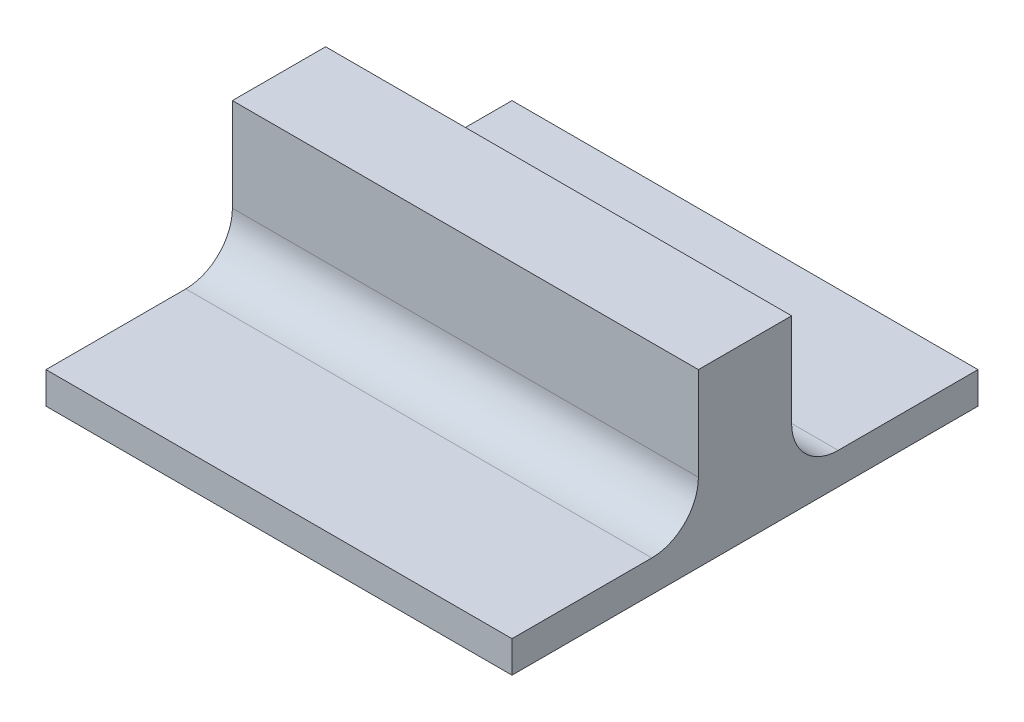
from build123d import *

# Parameters (mm, degrees)
SKETCH1_W           = 50
SKETCH1_H           = 50
BOSS_EXTRUDE1_DEPTH = 1.4
SKETCH2_W           = 50
SKETCH2_H           = 50
BOSS_EXTRUDE2_DEPTH = 2
SKETCH3_W           = 50
SKETCH3_H           = 10
BOSS_EXTRUDE3_DEPTH = 15
FILLET1_R           = 5


with BuildPart() as part:
    # Sketch1 → Boss-Extrude1 (new body)
    with BuildSketch(Plane(origin=(0, 0, 0), x_dir=(1, 0, 0), z_dir=(0, 1, 0))):
        Rectangle(SKETCH1_W, SKETCH1_H)
        Polygon((-13.067802911, 20), (-14.222503449, 22), (-16.531904526, 22), (-17.686605064, 20), (-16.531904526, 18), (-14.222503449, 18), align=None, mode=Mode.SUBTRACT)
        Polygon((-19.218684506, 20), (-20.373385044, 22), (-22.682786121, 22), (-23.837486659, 20), (-22.682786121, 18), (-20.373385044, 18), align=None, mode=Mode.SUBTRACT)
        Polygon((-6.916921316, 20), (-8.071621854, 22), (-10.381022931, 22), (-11.535723469, 20), (-10.381022931, 18), (-8.071621854, 18), align=None, mode=Mode.SUBTRACT)
        Polygon((-0.766039721, 20), (-1.920740259, 22), (-4.230141336, 22), (-5.384841874, 20), (-4.230141336, 18), (-1.920740259, 18), align=None, mode=Mode.SUBTRACT)
        Polygon((5.384841874, 20), (4.230141336, 22), (1.920740259, 22), (0.766039721, 20), (1.920740259, 18), (4.230141336, 18), align=None, mode=Mode.SUBTRACT)
        Polygon((11.535723469, 20), (10.381022931, 22), (8.071621854, 22), (6.916921316, 20), (8.071621854, 18), (10.381022931, 18), align=None, mode=Mode.SUBTRACT)
        Polygon((17.686605064, 20), (16.531904526, 22), (14.222503449, 22), (13.067802911, 20), (14.222503449, 18), (16.531904526, 18), align=None, mode=Mode.SUBTRACT)
        Polygon((23.837486659, 20), (22.682786121, 22), (20.373385044, 22), (19.218684506, 20), (20.373385044, 18), (22.682786121, 18), align=None, mode=Mode.SUBTRACT)
        Polygon((-13.067802911, 12), (-14.222503449, 14), (-16.531904526, 14), (-17.686605064, 12), (-16.531904526, 10), (-14.222503449, 10), align=None, mode=Mode.SUBTRACT)
        Polygon((-6.916921316, 12), (-8.071621854, 14), (-10.381022931, 14), (-11.535723469, 12), (-10.381022931, 10), (-8.071621854, 10), align=None, mode=Mode.SUBTRACT)
        Polygon((-0.766039721, 12), (-1.920740259, 14), (-4.230141336, 14), (-5.384841874, 12), (-4.230141336, 10), (-1.920740259, 10), align=None, mode=Mode.SUBTRACT)
        Polygon((5.384841874, 12), (4.230141336, 14), (1.920740259, 14), (0.766039721, 12), (1.920740259, 10), (4.230141336, 10), align=None, mode=Mode.SUBTRACT)
        Polygon((11.535723469, 12), (10.381022931, 14), (8.071621854, 14), (6.916921316, 12), (8.071621854, 10), (10.381022931, 10), align=None, mode=Mode.SUBTRACT)
        Polygon((17.686605064, 12), (16.531904526, 14), (14.222503449, 14), (13.067802911, 12), (14.222503449, 10), (16.531904526, 10), align=None, mode=Mode.SUBTRACT)
        Polygon((23.837486659, 12), (22.682786121, 14), (20.373385044, 14), (19.218684506, 12), (20.373385044, 10), (22.682786121, 10), align=None, mode=Mode.SUBTRACT)
        Polygon((-13.067802911, 4), (-14.222503449, 6), (-16.531904526, 6), (-17.686605064, 4), (-16.531904526, 2), (-14.222503449, 2), align=None, mode=Mode.SUBTRACT)
        Polygon((-6.916921316, 4), (-8.071621854, 6), (-10.381022931, 6), (-11.535723469, 4), (-10.381022931, 2), (-8.071621854, 2), align=None, mode=Mode.SUBTRACT)
        Polygon((-0.766039721, 4), (-1.920740259, 6), (-4.230141336, 6), (-5.384841874, 4), (-4.230141336, 2), (-1.920740259, 2), align=None, mode=Mode.SUBTRACT)
        Polygon((5.384841874, 4), (4.230141336, 6), (1.920740259, 6), (0.766039721, 4), (1.920740259, 2), (4.230141336, 2), align=None, mode=Mode.SUBTRACT)
        Polygon((11.535723469, 4), (10.381022931, 6), (8.071621854, 6), (6.916921316, 4), (8.071621854, 2), (10.381022931, 2), align=None, mode=Mode.SUBTRACT)
        Polygon((17.686605064, 4), (16.531904526, 6), (14.222503449, 6), (13.067802911, 4), (14.222503449, 2), (16.531904526, 2), align=None, mode=Mode.SUBTRACT)
        Polygon((23.837486659, 4), (22.682786121, 6), (20.373385044, 6), (19.218684506, 4), (20.373385044, 2), (22.682786121, 2), align=None, mode=Mode.SUBTRACT)
        Polygon((-13.067802911, -4), (-14.222503449, -2), (-16.531904526, -2), (-17.686605064, -4), (-16.531904526, -6), (-14.222503449, -6), align=None, mode=Mode.SUBTRACT)
        Polygon((-6.916921316, -4), (-8.071621854, -2), (-10.381022931, -2), (-11.535723469, -4), (-10.381022931, -6), (-8.071621854, -6), align=None, mode=Mode.SUBTRACT)
        Polygon((-0.766039721, -4), (-1.920740259, -2), (-4.230141336, -2), (-5.384841874, -4), (-4.230141336, -6), (-1.920740259, -6), align=None, mode=Mode.SUBTRACT)
        Polygon((5.384841874, -4), (4.230141336, -2), (1.920740259, -2), (0.766039721, -4), (1.920740259, -6), (4.230141336, -6), align=None, mode=Mode.SUBTRACT)
        Polygon((11.535723469, -4), (10.381022931, -2), (8.071621854, -2), (6.916921316, -4), (8.071621854, -6), (10.381022931, -6), align=None, mode=Mode.SUBTRACT)
        Polygon((17.686605064, -4), (16.531904526, -2), (14.222503449, -2), (13.067802911, -4), (14.222503449, -6), (16.531904526, -6), align=None, mode=Mode.SUBTRACT)
        Polygon((23.837486659, -4), (22.682786121, -2), (20.373385044, -2), (19.218684506, -4), (20.373385044, -6), (22.682786121, -6), align=None, mode=Mode.SUBTRACT)
        Polygon((-13.067802911, -12), (-14.222503449, -10), (-16.531904526, -10), (-17.686605064, -12), (-16.531904526, -14), (-14.222503449, -14), align=None, mode=Mode.SUBTRACT)
        Polygon((-6.916921316, -12), (-8.071621854, -10), (-10.381022931, -10), (-11.535723469, -12), (-10.381022931, -14), (-8.071621854, -14), align=None, mode=Mode.SUBTRACT)
        Polygon((-0.766039721, -12), (-1.920740259, -10), (-4.230141336, -10), (-5.384841874, -12), (-4.230141336, -14), (-1.920740259, -14), align=None, mode=Mode.SUBTRACT)
        Polygon((5.384841874, -12), (4.230141336, -10), (1.920740259, -10), (0.766039721, -12), (1.920740259, -14), (4.230141336, -14), align=None, mode=Mode.SUBTRACT)
        Polygon((11.535723469, -12), (10.381022931, -10), (8.071621854, -10), (6.916921316, -12), (8.071621854, -14), (10.381022931, -14), align=None, mode=Mode.SUBTRACT)
        Polygon((17.686605064, -12), (16.531904526, -10), (14.222503449, -10), (13.067802911, -12), (14.222503449, -14), (16.531904526, -14), align=None, mode=Mode.SUBTRACT)
        Polygon((23.837486659, -12), (22.682786121, -10), (20.373385044, -10), (19.218684506, -12), (20.373385044, -14), (22.682786121, -14), align=None, mode=Mode.SUBTRACT)
        Polygon((-13.067802911, -20), (-14.222503449, -18), (-16.531904526, -18), (-17.686605064, -20), (-16.531904526, -22), (-14.222503449, -22), align=None, mode=Mode.SUBTRACT)
        Polygon((-6.916921316, -20), (-8.071621854, -18), (-10.381022931, -18), (-11.535723469, -20), (-10.381022931, -22), (-8.071621854, -22), align=None, mode=Mode.SUBTRACT)
        Polygon((-0.766039721, -20), (-1.920740259, -18), (-4.230141336, -18), (-5.384841874, -20), (-4.230141336, -22), (-1.920740259, -22), align=None, mode=Mode.SUBTRACT)
        Polygon((5.384841874, -20), (4.230141336, -18), (1.920740259, -18), (0.766039721, -20), (1.920740259, -22), (4.230141336, -22), align=None, mode=Mode.SUBTRACT)
        Polygon((11.535723469, -20), (10.381022931, -18), (8.071621854, -18), (6.916921316, -20), (8.071621854, -22), (10.381022931, -22), align=None, mode=Mode.SUBTRACT)
        Polygon((17.686605064, -20), (16.531904526, -18), (14.222503449, -18), (13.067802911, -20), (14.222503449, -22), (16.531904526, -22), align=None, mode=Mode.SUBTRACT)
        Polygon((23.837486659, -20), (22.682786121, -18), (20.373385044, -18), (19.218684506, -20), (20.373385044, -22), (22.682786121, -22), align=None, mode=Mode.SUBTRACT)
        Polygon((-19.218684506, 12), (-20.373385044, 14), (-22.682786121, 14), (-23.837486659, 12), (-22.682786121, 10), (-20.373385044, 10), align=None, mode=Mode.SUBTRACT)
        Polygon((-19.218684506, 4), (-20.373385044, 6), (-22.682786121, 6), (-23.837486659, 4), (-22.682786121, 2), (-20.373385044, 2), align=None, mode=Mode.SUBTRACT)
        Polygon((-19.218684506, -4), (-20.373385044, -2), (-22.682786121, -2), (-23.837486659, -4), (-22.682786121, -6), (-20.373385044, -6), align=None, mode=Mode.SUBTRACT)
        Polygon((-19.218684506, -12), (-20.373385044, -10), (-22.682786121, -10), (-23.837486659, -12), (-22.682786121, -14), (-20.373385044, -14), align=None, mode=Mode.SUBTRACT)
        Polygon((-19.218684506, -20), (-20.373385044, -18), (-22.682786121, -18), (-23.837486659, -20), (-22.682786121, -22), (-20.373385044, -22), align=None, mode=Mode.SUBTRACT)
    extrude(amount=BOSS_EXTRUDE1_DEPTH)

    # Sketch2 → Boss-Extrude2 (add)
    with BuildSketch(Plane(origin=(0, 1.4, 0), x_dir=(1, 0, 0), z_dir=(0, 1, 0))):
        Rectangle(SKETCH2_W, SKETCH2_H)
    extrude(amount=BOSS_EXTRUDE2_DEPTH)

    # Sketch3 → Boss-Extrude3 (add)
    with BuildSketch(Plane(origin=(0, 3.4, 0), x_dir=(1, 0, 0), z_dir=(0, 1, 0))):
        Rectangle(SKETCH3_W, SKETCH3_H)
    extrude(amount=BOSS_EXTRUDE3_DEPTH)

    # Fillet1
    fillet1_edges = [part.edges().sort_by_distance(p)[0] for p in [
        (0, 3.4, -5),
        (0, 3.4, 5),
    ]]
    fillet(fillet1_edges, radius=FILLET1_R)


solid = part.part
